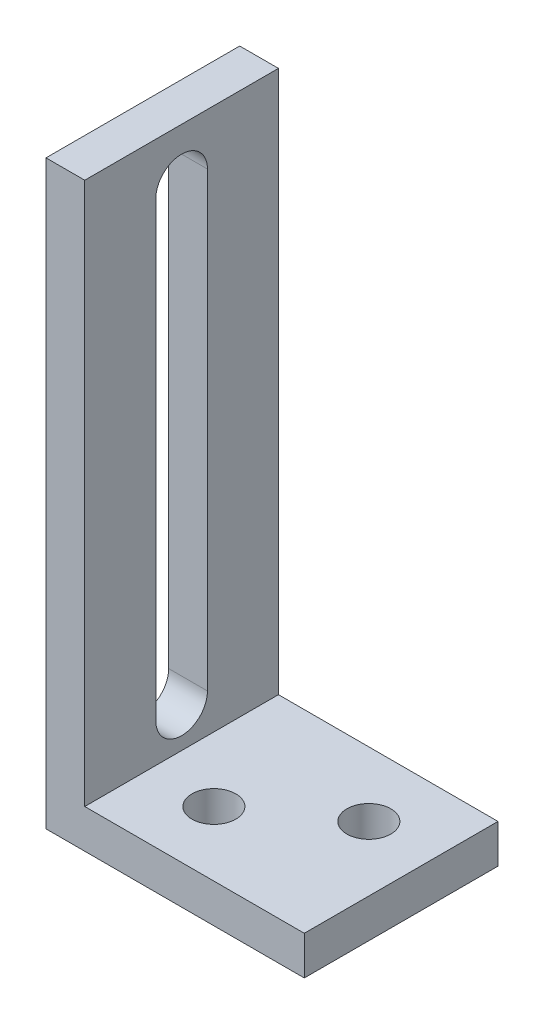
from build123d import *

# Parameters (mm, degrees)
BOSS_EXTRUDE1_DEPTH = 15
CUT_EXTRUDE1_DEPTH  = 6
CUT_EXTRUDE2_REACH  = 50.877
SKETCH3_R           = 1.7


with BuildPart() as part:
    # Sketch1 → Boss-Extrude1 (new body)
    with BuildSketch(Plane.XY):
        Polygon((3, 45), (3, 3), (20, 3), (20, 0), (0, 0), (0, 45), align=None)
    extrude(amount=BOSS_EXTRUDE1_DEPTH)

    # Sketch2 → Cut-Extrude1 (cut)
    with BuildSketch(Plane.ZY):
        with BuildLine():
            ThreePointArc((5.5, 6), (6.085786438, 4.585786438), (7.5, 4))
            Line((7.5, 4), (7.5, 8))
            ThreePointArc((7.5, 8), (6.085786438, 7.414213562), (5.5, 6))
        make_face()
        with BuildLine():
            Line((7.5, 8), (7.5, 4))
            ThreePointArc((7.5, 4), (8.914213562, 4.585786438), (9.5, 6))
            ThreePointArc((9.5, 6), (8.914213562, 7.414213562), (7.5, 8))
        make_face()
        with BuildLine():
            ThreePointArc((5.5, 41), (6.085786438, 39.585786438), (7.5, 39))
            Line((7.5, 39), (7.5, 43))
            ThreePointArc((7.5, 43), (6.085786438, 42.414213562), (5.5, 41))
        make_face()
        with BuildLine():
            Line((7.5, 43), (7.5, 39))
            ThreePointArc((7.5, 39), (8.914213562, 39.585786438), (9.5, 41))
            ThreePointArc((9.5, 41), (8.914213562, 42.414213562), (7.5, 43))
        make_face()
        with BuildLine():
            ThreePointArc((5.5, 6), (6.085786438, 7.414213562), (7.5, 8))
            Line((7.5, 8), (7.5, 39))
            ThreePointArc((7.5, 39), (6.085786438, 39.585786438), (5.5, 41))
            Line((5.5, 41), (5.5, 6))
        make_face()
        with BuildLine():
            Line((7.5, 39), (7.5, 8))
            ThreePointArc((7.5, 8), (8.914213562, 7.414213562), (9.5, 6))
            Line((9.5, 6), (9.5, 41))
            ThreePointArc((9.5, 41), (8.914213562, 39.585786438), (7.5, 39))
        make_face()
    extrude(amount=-CUT_EXTRUDE1_DEPTH, mode=Mode.SUBTRACT)

    # Sketch3 → Cut-Extrude2 (cut, up to next)
    with BuildSketch(Plane(origin=(0, 3, 0), x_dir=(1, 0, 0), z_dir=(0, 1, 0)), mode=Mode.PRIVATE) as cut_extrude2_sk1:
        with Locations(Location((8, -10, 0), (0, 0, 270))):
            Circle(SKETCH3_R)
    cut_extrude2_tool1 = extrude(cut_extrude2_sk1.sketch, amount=-CUT_EXTRUDE2_REACH, mode=Mode.PRIVATE) & part.part
    # Sketch3 → Cut-Extrude2 (cut, up to next)
    with BuildSketch(Plane(origin=(0, 3, 0), x_dir=(1, 0, 0), z_dir=(0, 1, 0)), mode=Mode.PRIVATE) as cut_extrude2_sk2:
        with Locations(Location((15, -5, 0), (0, 0, 270))):
            Circle(SKETCH3_R)
    cut_extrude2_tool2 = extrude(cut_extrude2_sk2.sketch, amount=-CUT_EXTRUDE2_REACH, mode=Mode.PRIVATE) & part.part
    add(cut_extrude2_tool1.solids().sort_by_distance((8, 3, 10))[0], mode=Mode.SUBTRACT)
    add(cut_extrude2_tool2.solids().sort_by_distance((15, 3, 5))[0], mode=Mode.SUBTRACT)


solid = part.part
